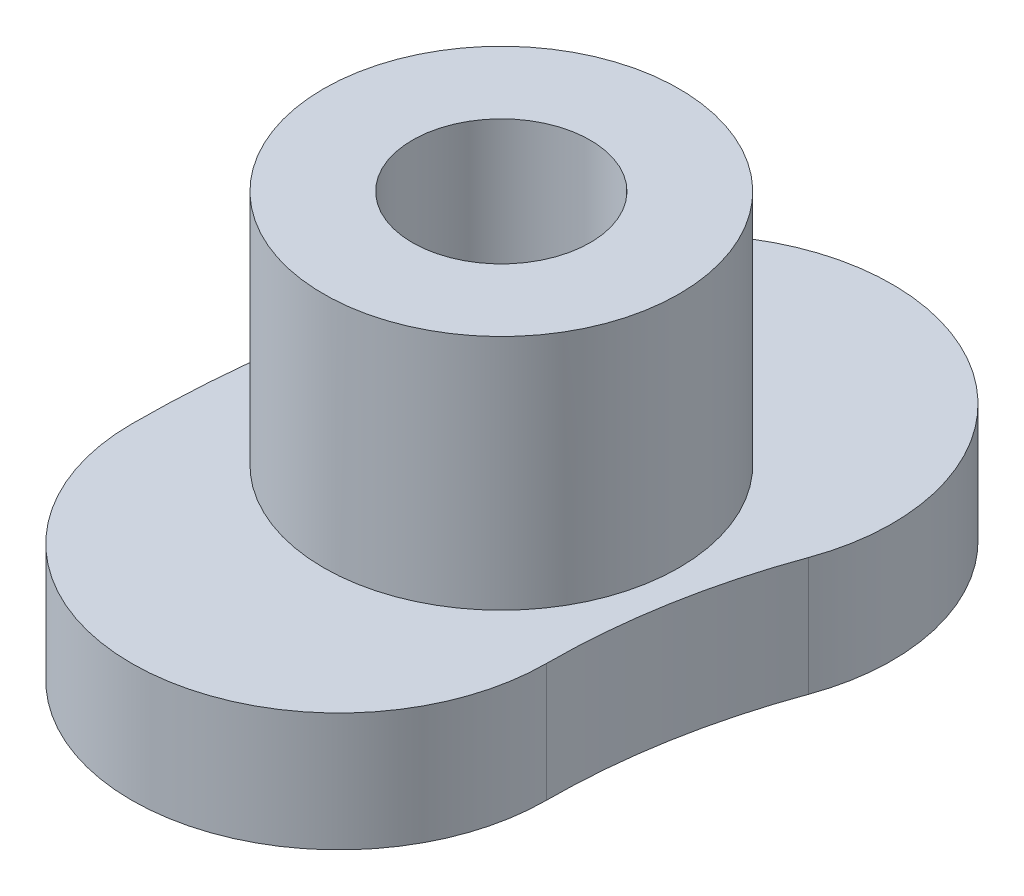
from build123d import *

# Parameters (mm, degrees)
SKETCH_2_R        = 1.5
EXTRUDE_1_DEPTH   = 2
SKETCH_2_3_R      = 3
SKETCH_2_3_R_2    = 1.5
EXTRUDE_1_2_DEPTH = 6


with BuildPart() as part:
    # 草图2 → Extrude 1 (new body)
    with BuildSketch(Plane(origin=(0, 0, 0), x_dir=(1, 0, 0), z_dir=(0, 1, 0))):
        with BuildLine():
            ThreePointArc((-16.914467174, 6.15636258), (-17.726539554, 3.125667198), (-18, 0))
            ThreePointArc((-18, 0), (-14.5, -3.5), (-11, 0))
            ThreePointArc((-11, 0), (-10.832885283, 1.910129954), (-10.336618829, 3.762221577))
            ThreePointArc((-10.336618829, 3.762221577), (-12.4284725, 8.248216251), (-16.914467174, 6.15636258))
        make_face()
        with Locations(Location((-14.279712419, 2.517898576, 0), (0, 0, 270))):
            Circle(SKETCH_2_R, mode=Mode.SUBTRACT)
    extrude(amount=EXTRUDE_1_DEPTH)

    # 草图2<3> → Extrude 1 2 (add)
    with BuildSketch(Plane(origin=(0, 0, 0), x_dir=(1, 0, 0), z_dir=(0, 1, 0))):
        with Locations((-14.279712419, 2.517898576)):
            Circle(SKETCH_2_3_R)
        with Locations((-14.279712419, 2.517898576)):
            Circle(SKETCH_2_3_R_2, mode=Mode.SUBTRACT)
    extrude(amount=EXTRUDE_1_2_DEPTH)


solid = part.part
